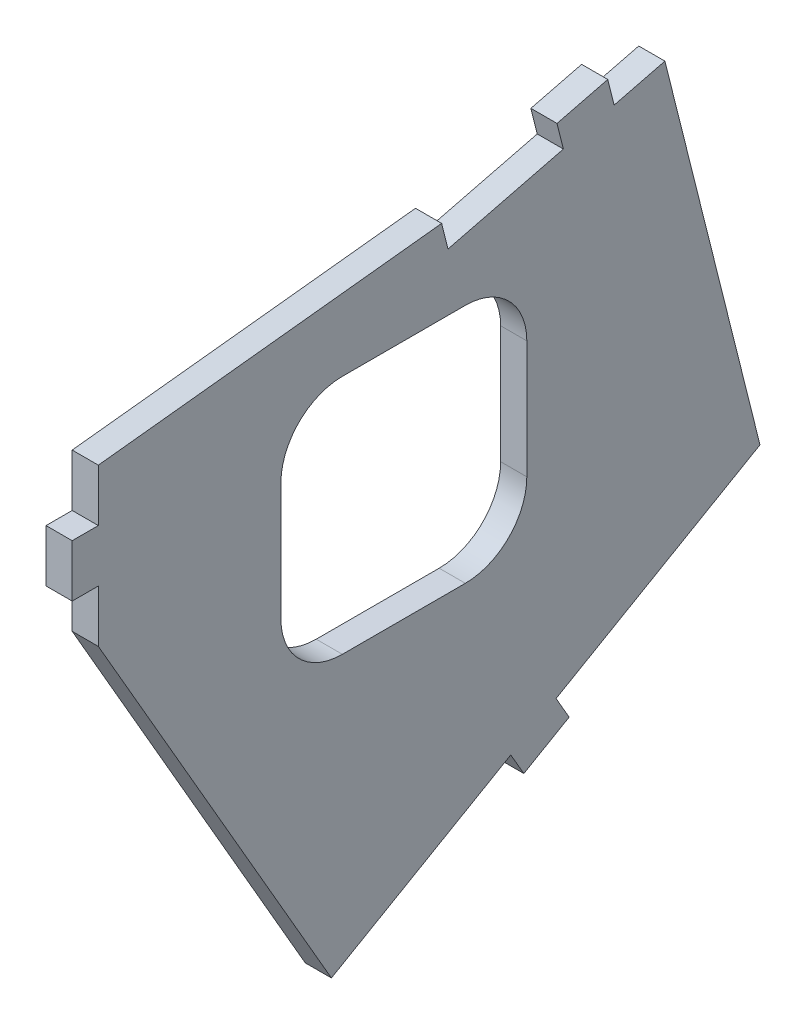
from build123d import *

# Parameters (mm, degrees)
BOSS_EXTRU_1_DEPTH = 5


with BuildPart() as part:
    # Esquisse1 → Boss.-Extru.1 (new body)
    with BuildSketch(Plane(origin=(0, 0, 0), x_dir=(0, 0, -1), z_dir=(1, 0, 0))):
        Polygon((20.428249593, -55.741422484), (-13.843425106, -75.528183097), (-58.387612711, 1.624613017), (-58.387612711, 11.624613017), (-63.387612711, 11.624613017), (-63.387612711, 21.624613017), (-58.387612711, 21.624613017), (-58.387612711, 31.624613017), (7.224475537, 38.834467888), (8.438400995, 33.984067391), (30.488285558, 39.502563492), (29.2743601, 44.352963989), (38.975161094, 46.780814906), (40.189086552, 41.930414409), (49.889887546, 44.358265326), (68.059646801, -28.241422484), (29.08850363, -50.741422484), (31.58850363, -55.071549503), (22.928249593, -60.071549503), align=None)
        with BuildLine():
            Line((-11.75, 23), (11.75, 23))
            ThreePointArc((11.75, 23), (20.058504679, 19.558504679), (23.5, 11.25))
            Line((23.5, 11.25), (23.5, -11.25))
            ThreePointArc((23.5, -11.25), (20.058504679, -19.558504679), (11.75, -23))
            Line((11.75, -23), (-11.75, -23))
            ThreePointArc((-11.75, -23), (-20.058504679, -19.558504679), (-23.5, -11.25))
            Line((-23.5, -11.25), (-23.5, 11.25))
            ThreePointArc((-23.5, 11.25), (-20.058504679, 19.558504679), (-11.75, 23))
        make_face(mode=Mode.SUBTRACT)
    extrude(amount=BOSS_EXTRU_1_DEPTH)


solid = part.part
